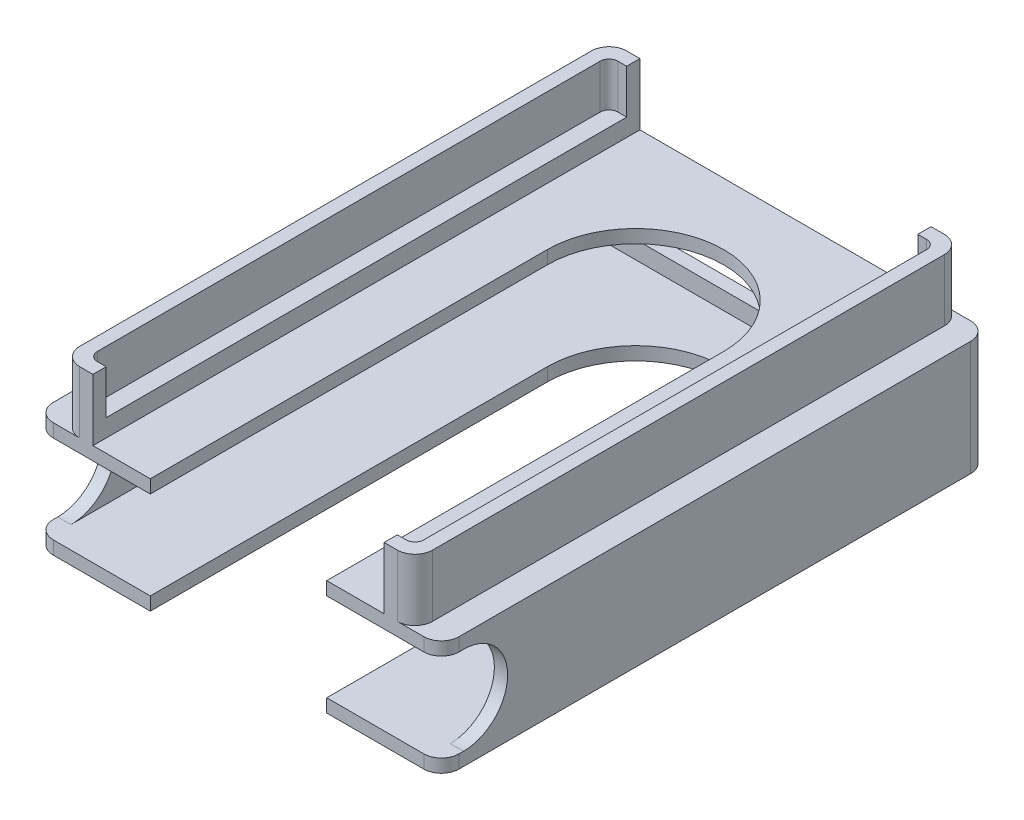
from build123d import *

# Parameters (mm, degrees)
BASE_EXTRUDE_DEPTH        = 0.75
SIDEWALL_EXTRUDE_DEPTH    = 5.75
TOP_EXTRUDE_START         = 5.75
TOP_EXTRUDE_DEPTH         = 0.75
CUT_EXTRUDE1_DEPTH        = 29.901773302
CUT_EXTRUDE1_DEPTH_BACK   = 29.901773302
PCB_SUPPORT_EXTRUDE_DEPTH = 1
PCB_RIM_EXTRUDE_DEPTH     = 3.5
CUT_EXTRUDE2_DEPTH        = 21.941883869
CUT_EXTRUDE3_DEPTH        = 3.5


with BuildPart() as part:
    # battery-base → base-extrude (new body)
    with BuildSketch(Plane(origin=(0, 0, 0), x_dir=(1, 0, 0), z_dir=(0, 1, 0))):
        with BuildLine():
            Line((-10.5, 16.25), (10.5, 16.25))
            ThreePointArc((10.5, 16.25), (11.207106781, 15.957106781), (11.5, 15.25))
            Line((11.5, 15.25), (11.5, -13.75))
            ThreePointArc((11.5, -13.75), (11.207106781, -14.457106781), (10.5, -14.75))
            Line((10.5, -14.75), (-10.5, -14.75))
            ThreePointArc((-10.5, -14.75), (-11.207106781, -14.457106781), (-11.5, -13.75))
            Line((-11.5, -13.75), (-11.5, 15.25))
            ThreePointArc((-11.5, 15.25), (-11.207106781, 15.957106781), (-10.5, 16.25))
        make_face()
    extrude(amount=BASE_EXTRUDE_DEPTH)

    # battery-base<12> → sidewall-extrude (add)
    with BuildSketch(Plane(origin=(0, 0, 0), x_dir=(1, 0, 0), z_dir=(0, 1, 0))):
        with BuildLine():
            Line((-11.5, -13.5), (-10.75, -13.5))
            Line((-10.75, -13.5), (-10.75, 15))
            ThreePointArc((-10.75, 15), (-10.603553391, 15.353553391), (-10.25, 15.5))
            Line((-10.25, 15.5), (10.25, 15.5))
            ThreePointArc((10.25, 15.5), (10.603553391, 15.353553391), (10.75, 15))
            Line((10.75, 15), (10.75, -13.5))
            Line((10.75, -13.5), (11.5, -13.5))
            Line((11.5, -13.5), (11.5, 15.25))
            ThreePointArc((11.5, 15.25), (11.207106781, 15.957106781), (10.5, 16.25))
            Line((10.5, 16.25), (-10.5, 16.25))
            ThreePointArc((-10.5, 16.25), (-11.207106781, 15.957106781), (-11.5, 15.25))
            Line((-11.5, 15.25), (-11.5, -13.5))
        make_face()
    extrude(amount=SIDEWALL_EXTRUDE_DEPTH)

    # battery-base<13> → top-extrude (add)
    with BuildSketch(Plane(origin=(0, 0, 0), x_dir=(1, 0, 0), z_dir=(0, 1, 0)).offset(TOP_EXTRUDE_START)):
        with BuildLine():
            Line((11.5, -13.75), (11.5, 15.25))
            ThreePointArc((11.5, 15.25), (11.207106781, 15.957106781), (10.5, 16.25))
            Line((10.5, 16.25), (-10.5, 16.25))
            ThreePointArc((-10.5, 16.25), (-11.207106781, 15.957106781), (-11.5, 15.25))
            Line((-11.5, 15.25), (-11.5, -13.75))
            ThreePointArc((-11.5, -13.75), (-11.207106781, -14.457106781), (-10.5, -14.75))
            Line((-10.5, -14.75), (10.5, -14.75))
            ThreePointArc((10.5, -14.75), (11.207106781, -14.457106781), (11.5, -13.75))
        make_face()
    extrude(amount=TOP_EXTRUDE_DEPTH)

    # round-cut → Cut-Extrude1 (cut, two sides: drawn at the far end of the back side and taken through both)
    with BuildSketch(Plane(origin=(11.5, 0, 0), x_dir=(0, 0, -1), z_dir=(1, 0, 0)).offset(-CUT_EXTRUDE1_DEPTH_BACK)):
        with BuildLine():
            Line((-84.101155105, 0.75), (-13.5, 0.75))
            ThreePointArc((-13.5, 0.75), (-11, 3.25), (-13.5, 5.75))
            Line((-13.5, 5.75), (-84.101155105, 5.75))
            Line((-84.101155105, 5.75), (-225.303465314, 5.75))
            Line((-225.303465314, 5.75), (-225.303465314, 0.75))
            Line((-225.303465314, 0.75), (-84.101155105, 0.75))
        make_face()
    extrude(amount=CUT_EXTRUDE1_DEPTH + CUT_EXTRUDE1_DEPTH_BACK, mode=Mode.SUBTRACT)

    # PCB-support → PCB-support-extrude (add)
    with BuildSketch(Plane(origin=(0, 6.5, 0), x_dir=(1, 0, 0), z_dir=(0, 1, 0))):
        with BuildLine():
            Line((-8.75, -14), (-8.25, -14))
            Line((-8.25, -14), (-8.25, 15.5))
            Line((-8.25, 15.5), (-8.75, 15.5))
            ThreePointArc((-8.75, 15.5), (-9.103553391, 15.353553391), (-9.25, 15))
            Line((-9.25, 15), (-9.25, -13.5))
            ThreePointArc((-9.25, -13.5), (-9.103553391, -13.853553391), (-8.75, -14))
        make_face()
        with BuildLine():
            Line((8.25, 15.5), (8.25, -14))
            Line((8.25, -14), (8.75, -14))
            ThreePointArc((8.75, -14), (9.103553391, -13.853553391), (9.25, -13.5))
            Line((9.25, -13.5), (9.25, 15))
            ThreePointArc((9.25, 15), (9.103553391, 15.353553391), (8.75, 15.5))
            Line((8.75, 15.5), (8.25, 15.5))
        make_face()
    extrude(amount=PCB_SUPPORT_EXTRUDE_DEPTH)

    # PCB-support<3> → PCB-rim-extrude (add)
    with BuildSketch(Plane(origin=(0, 6.5, 0), x_dir=(1, 0, 0), z_dir=(0, 1, 0))):
        with BuildLine():
            Line((-8.25, -14.75), (-8.25, -14))
            Line((-8.25, -14), (-8.75, -14))
            ThreePointArc((-8.75, -14), (-9.103553391, -13.853553391), (-9.25, -13.5))
            Line((-9.25, -13.5), (-9.25, 15))
            ThreePointArc((-9.25, 15), (-9.103553391, 15.353553391), (-8.75, 15.5))
            Line((-8.75, 15.5), (-8.25, 15.5))
            Line((-8.25, 15.5), (-8.25, 16.25))
            Line((-8.25, 16.25), (-9, 16.25))
            ThreePointArc((-9, 16.25), (-9.707106781, 15.957106781), (-10, 15.25))
            Line((-10, 15.25), (-10, -13.75))
            ThreePointArc((-10, -13.75), (-9.707106781, -14.457106781), (-9, -14.75))
            Line((-9, -14.75), (-8.25, -14.75))
        make_face()
        with BuildLine():
            Line((8.75, -14), (8.25, -14))
            Line((8.25, -14), (8.25, -14.75))
            Line((8.25, -14.75), (9, -14.75))
            ThreePointArc((9, -14.75), (9.707106781, -14.457106781), (10, -13.75))
            Line((10, -13.75), (10, 15.25))
            ThreePointArc((10, 15.25), (9.707106781, 15.957106781), (9, 16.25))
            Line((9, 16.25), (8.25, 16.25))
            Line((8.25, 16.25), (8.25, 15.5))
            Line((8.25, 15.5), (8.75, 15.5))
            ThreePointArc((8.75, 15.5), (9.103553391, 15.353553391), (9.25, 15))
            Line((9.25, 15), (9.25, -13.5))
            ThreePointArc((9.25, -13.5), (9.103553391, -13.853553391), (8.75, -14))
        make_face()
    extrude(amount=PCB_RIM_EXTRUDE_DEPTH)

    # cut-away → Cut-Extrude2 (cut, through all)
    with BuildSketch(Plane(origin=(0, 6.5, 0), x_dir=(1, 0, 0), z_dir=(0, 1, 0))):
        with BuildLine():
            Line((-5, 7.75), (-5, -14.75))
            Line((-5, -14.75), (5, -14.75))
            Line((5, -14.75), (5, 7.75))
            ThreePointArc((5, 7.75), (0, 12.75), (-5, 7.75))
        make_face()
    extrude(amount=-CUT_EXTRUDE2_DEPTH, mode=Mode.SUBTRACT)

    # Sketch7 → Cut-Extrude3 (cut)
    with BuildSketch(Plane(origin=(0, 0, -16.25), x_dir=(-1, 0, 0), z_dir=(0, 0, -1))):
        with BuildLine():
            Line((8.584888193, 1.75), (-8.584888193, 1.75))
            ThreePointArc((-8.584888193, 1.75), (-10.084888193, 3.25), (-8.584888193, 4.75))
            Line((-8.584888193, 4.75), (8.584888193, 4.75))
            ThreePointArc((8.584888193, 4.75), (10.084888193, 3.25), (8.584888193, 1.75))
        make_face()
    extrude(amount=-CUT_EXTRUDE3_DEPTH, mode=Mode.SUBTRACT)


solid = part.part
